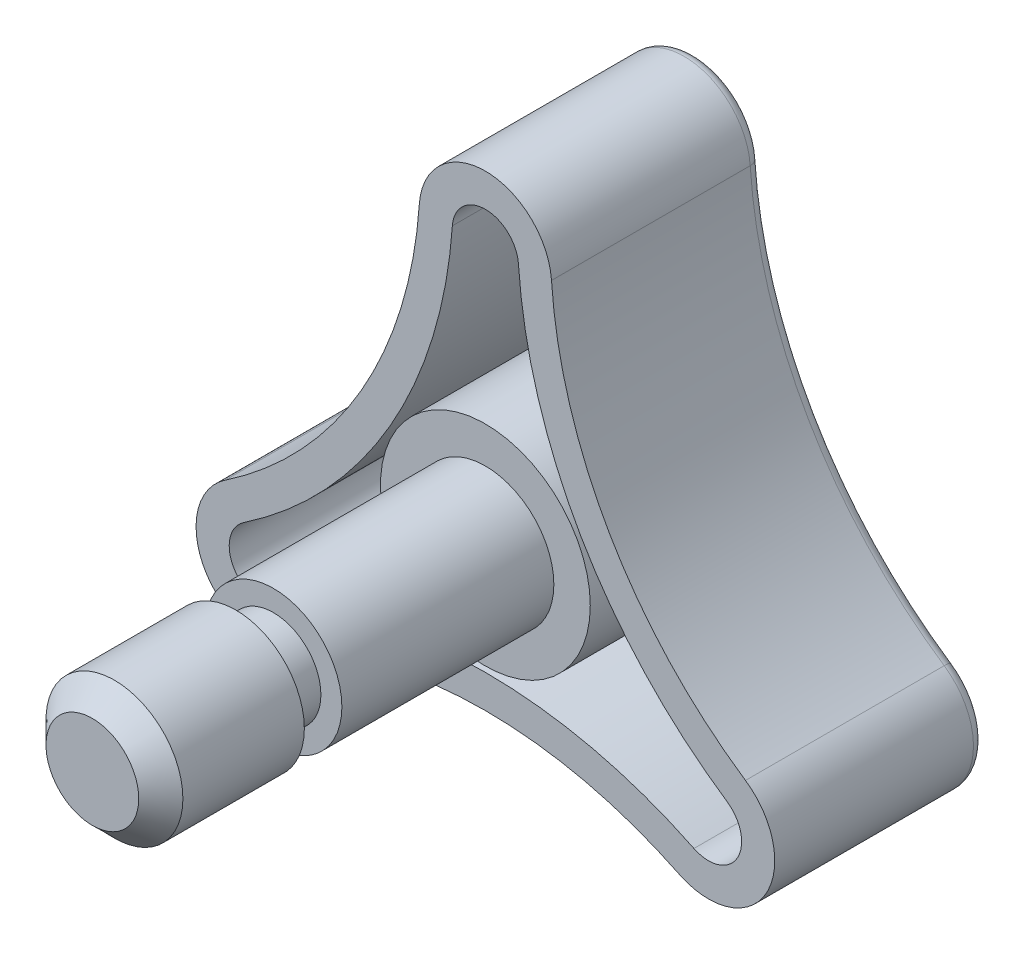
from build123d import *

# Parameters (mm, degrees)
BOSS_EXTRUDE1_DEPTH = 9.5
SHELL1_T            = -1.5
FILLET2_R           = 0.5
SKETCH2_R           = 4.75
BOSS_EXTRUDE2_DEPTH = 8
SKETCH4_R           = 3.1
BOSS_EXTRUDE3_DEPTH = 17.8
SKETCH5_R           = 5
SKETCH5_R_2         = 2.15
CUT_EXTRUDE1_DEPTH  = 1.7
CHAMFER1_SIZE       = 1


with BuildPart() as part:
    # Sketch1 → Boss-Extrude1 (new body)
    with BuildSketch(Plane.XY):
        with BuildLine():
            ThreePointArc((2.992904177, 11.872881569), (0, 14.666666667), (-2.992904177, 11.872881569))
            ThreePointArc((-2.992904177, 11.872881569), (-5.625090617, 3.247647582), (-11.778669143, -3.344509736))
            ThreePointArc((-11.778669143, -3.344509736), (-12.701705922, -7.333333333), (-8.785764966, -8.528371833))
            ThreePointArc((-8.785764966, -8.528371833), (0, -6.495295163), (8.785764966, -8.528371833))
            ThreePointArc((8.785764966, -8.528371833), (12.701705922, -7.333333333), (11.778669143, -3.344509736))
            ThreePointArc((11.778669143, -3.344509736), (5.625090617, 3.247647582), (2.992904177, 11.872881569))
        make_face()
    extrude(amount=BOSS_EXTRUDE1_DEPTH)

    # Shell1
    shell1_openings = [part.faces().sort_by_distance(p)[0] for p in [
        (0, 0, 9.5),
    ]]
    offset(amount=SHELL1_T, openings=shell1_openings, kind=Kind.INTERSECTION)

    # Fillet2
    fillet2_edges = [part.edges().sort_by_distance(p)[0] for p in [
        (-12.701705922, -7.333333333, 0),
        (-5.625090617, 3.247647582, 0),
        (0, 14.666666667, 0),
        (5.625090617, 3.247647582, 0),
        (12.701705922, -7.333333333, 0),
        (0, -6.495295163, 0),
    ]]
    fillet(fillet2_edges, radius=FILLET2_R)

    # Sketch2 → Boss-Extrude2 (add)
    with BuildSketch(Plane.XY.offset(1.5)):
        Circle(SKETCH2_R)
    extrude(amount=BOSS_EXTRUDE2_DEPTH)

    # Sketch4 → Boss-Extrude3 (add)
    with BuildSketch(Plane.XY.offset(9.5)):
        Circle(SKETCH4_R)
    extrude(amount=BOSS_EXTRUDE3_DEPTH)

    # Sketch5 → Cut-Extrude1 (cut)
    with BuildSketch(Plane.XY.offset(20.8)):
        Circle(SKETCH5_R)
        Circle(SKETCH5_R_2, mode=Mode.SUBTRACT)
    extrude(amount=-CUT_EXTRUDE1_DEPTH, mode=Mode.SUBTRACT)

    # Chamfer1
    chamfer1_edges = [part.edges().sort_by_distance(p)[0] for p in [
        (-3.1, 0, 27.3),
    ]]
    chamfer(chamfer1_edges, length=CHAMFER1_SIZE)


solid = part.part
